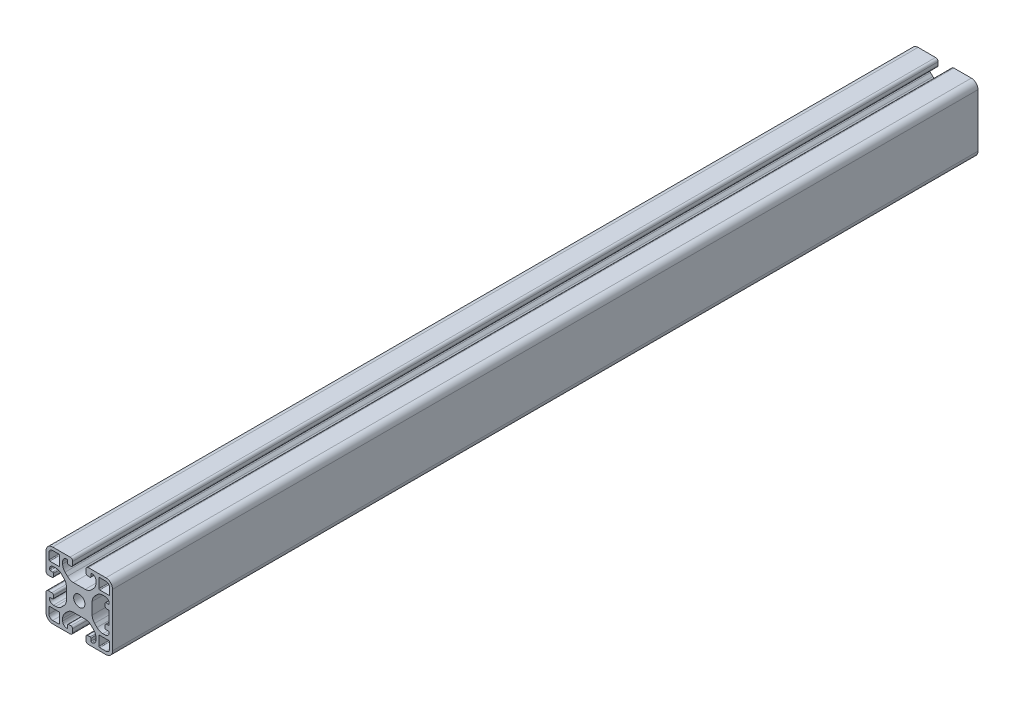
from build123d import *

# Parameters (mm, degrees)
SCHIZZO1_R                   = 3.4
ESTRUSIONE_ESTRUSIONE1_DEPTH = 520


with BuildPart() as part:
    # Schizzo1 → Estrusione-Estrusione1 (new body)
    with BuildSketch(Plane(origin=(0, 0, -340), x_dir=(-1, 0, 0), z_dir=(0, 0, -1))):
        with BuildLine():
            Line((6.5, -15.5), (5, -15.5))
            ThreePointArc((5, -15.5), (4.292893219, -15.792893219), (4, -16.5))
            Line((4, -16.5), (4, -18.5))
            ThreePointArc((4, -18.5), (4.439339828, -19.560660172), (5.5, -20))
            Line((5.5, -20), (16, -20))
            ThreePointArc((16, -20), (18.828427125, -18.828427125), (20, -16))
            Line((20, -16), (20, -5.5))
            ThreePointArc((20, -5.5), (19.560660172, -4.439339828), (18.5, -4))
            Line((18.5, -4), (16.5, -4))
            ThreePointArc((16.5, -4), (15.792893219, -4.292893219), (15.5, -5))
            Line((15.5, -5), (15.5, -6.5))
            ThreePointArc((15.5, -6.5), (15.646446609, -6.853553391), (16, -7))
            Line((16, -7), (17.55, -7))
            ThreePointArc((17.55, -7), (17.868198052, -7.131801948), (18, -7.45))
            Line((18, -7.45), (18, -7.5))
            ThreePointArc((18, -7.5), (17.267766953, -9.267766953), (15.5, -10))
            Line((15.5, -10), (14.192388155, -10))
            ThreePointArc((14.192388155, -10), (12.278970994, -9.619397663), (10.656854249, -8.535533906))
            Line((10.656854249, -8.535533906), (9.214466094, -7.09314575))
            ThreePointArc((9.214466094, -7.09314575), (8.130602337, -5.471029006), (7.75, -3.557611845))
            Line((7.75, -3.557611845), (7.75, 3.557611845))
            ThreePointArc((7.75, 3.557611845), (8.130602337, 5.471029006), (9.214466094, 7.09314575))
            Line((9.214466094, 7.09314575), (10.656854249, 8.535533906))
            ThreePointArc((10.656854249, 8.535533906), (12.278970994, 9.619397663), (14.192388155, 10))
            Line((14.192388155, 10), (15.5, 10))
            ThreePointArc((15.5, 10), (17.267766953, 9.267766953), (18, 7.5))
            Line((18, 7.5), (18, 7.45))
            ThreePointArc((18, 7.45), (17.868198052, 7.131801948), (17.55, 7))
            Line((17.55, 7), (16, 7))
            ThreePointArc((16, 7), (15.646446609, 6.853553391), (15.5, 6.5))
            Line((15.5, 6.5), (15.5, 5))
            ThreePointArc((15.5, 5), (15.792893219, 4.292893219), (16.5, 4))
            Line((16.5, 4), (18.5, 4))
            ThreePointArc((18.5, 4), (19.560660172, 4.439339828), (20, 5.5))
            Line((20, 5.5), (20, 16))
            ThreePointArc((20, 16), (18.828427125, 18.828427125), (16, 20))
            Line((16, 20), (5.5, 20))
            ThreePointArc((5.5, 20), (4.439339828, 19.560660172), (4, 18.5))
            Line((4, 18.5), (4, 16.5))
            ThreePointArc((4, 16.5), (4.292893219, 15.792893219), (5, 15.5))
            Line((5, 15.5), (6.5, 15.5))
            ThreePointArc((6.5, 15.5), (6.853553391, 15.646446609), (7, 16))
            Line((7, 16), (7, 17.55))
            ThreePointArc((7, 17.55), (7.131801948, 17.868198052), (7.45, 18))
            Line((7.45, 18), (7.5, 18))
            ThreePointArc((7.5, 18), (9.267766953, 17.267766953), (10, 15.5))
            Line((10, 15.5), (10, 14.192388155))
            ThreePointArc((10, 14.192388155), (9.619397663, 12.278970994), (8.535533906, 10.656854249))
            Line((8.535533906, 10.656854249), (7.09314575, 9.214466094))
            ThreePointArc((7.09314575, 9.214466094), (5.471029006, 8.130602337), (3.557611844, 7.75))
            Line((3.557611844, 7.75), (-3.557611845, 7.75))
            ThreePointArc((-3.557611845, 7.75), (-5.471029006, 8.130602337), (-7.09314575, 9.214466094))
            Line((-7.09314575, 9.214466094), (-8.535533906, 10.656854249))
            ThreePointArc((-8.535533906, 10.656854249), (-9.619397663, 12.278970994), (-10, 14.192388155))
            Line((-10, 14.192388155), (-10, 15.5))
            ThreePointArc((-10, 15.5), (-9.267766953, 17.267766953), (-7.5, 18))
            Line((-7.5, 18), (-7.45, 18))
            ThreePointArc((-7.45, 18), (-7.131801948, 17.868198052), (-7, 17.55))
            Line((-7, 17.55), (-7, 16))
            ThreePointArc((-7, 16), (-6.853553391, 15.646446609), (-6.5, 15.5))
            Line((-6.5, 15.5), (-5, 15.5))
            ThreePointArc((-5, 15.5), (-4.292893219, 15.792893219), (-4, 16.5))
            Line((-4, 16.5), (-4, 18.5))
            ThreePointArc((-4, 18.5), (-4.439339828, 19.560660172), (-5.5, 20))
            Line((-5.5, 20), (-16, 20))
            ThreePointArc((-16, 20), (-18.828427125, 18.828427125), (-20, 16))
            Line((-20, 16), (-20, -16))
            ThreePointArc((-20, -16), (-18.828427125, -18.828427125), (-16, -20))
            Line((-16, -20), (-5.5, -20))
            ThreePointArc((-5.5, -20), (-4.439339828, -19.560660172), (-4, -18.5))
            Line((-4, -18.5), (-4, -16.5))
            ThreePointArc((-4, -16.5), (-4.292893219, -15.792893219), (-5, -15.5))
            Line((-5, -15.5), (-6.5, -15.5))
            ThreePointArc((-6.5, -15.5), (-6.853553391, -15.646446609), (-7, -16))
            Line((-7, -16), (-7, -17.55))
            ThreePointArc((-7, -17.55), (-7.131801948, -17.868198052), (-7.45, -18))
            Line((-7.45, -18), (-7.5, -18))
            ThreePointArc((-7.5, -18), (-9.267766953, -17.267766953), (-10, -15.5))
            Line((-10, -15.5), (-10, -14.192388155))
            ThreePointArc((-10, -14.192388155), (-9.619397663, -12.278970994), (-8.535533906, -10.656854249))
            Line((-8.535533906, -10.656854249), (-7.09314575, -9.214466094))
            ThreePointArc((-7.09314575, -9.214466094), (-5.471029006, -8.130602337), (-3.557611845, -7.75))
            Line((-3.557611845, -7.75), (3.557611845, -7.75))
            ThreePointArc((3.557611845, -7.75), (5.471029006, -8.130602337), (7.09314575, -9.214466094))
            Line((7.09314575, -9.214466094), (8.535533906, -10.656854249))
            ThreePointArc((8.535533906, -10.656854249), (9.619397663, -12.278970994), (10, -14.192388155))
            Line((10, -14.192388155), (10, -15.5))
            ThreePointArc((10, -15.5), (9.267766953, -17.267766953), (7.5, -18))
            Line((7.5, -18), (7.45, -18))
            ThreePointArc((7.45, -18), (7.131801948, -17.868198052), (7, -17.55))
            Line((7, -17.55), (7, -16))
            ThreePointArc((7, -16), (6.853553391, -15.646446609), (6.5, -15.5))
        make_face()
        with Locations(Location((0, 0, 0), (0, 0, 180))):
            Circle(SCHIZZO1_R, mode=Mode.SUBTRACT)
        with BuildLine():
            Line((-12.3, -18.2), (-16, -18.2))
            ThreePointArc((-16, -18.2), (-17.555634919, -17.555634919), (-18.2, -16))
            Line((-18.2, -16), (-18.2, -12.3))
            ThreePointArc((-18.2, -12.3), (-18.053553391, -11.946446609), (-17.7, -11.8))
            Line((-17.7, -11.8), (-12.3, -11.8))
            ThreePointArc((-12.3, -11.8), (-11.946446609, -11.946446609), (-11.8, -12.3))
            Line((-11.8, -12.3), (-11.8, -17.7))
            ThreePointArc((-11.8, -17.7), (-11.946446609, -18.053553391), (-12.3, -18.2))
        make_face(mode=Mode.SUBTRACT)
        with BuildLine():
            Line((-11.8, 17.7), (-11.8, 12.3))
            ThreePointArc((-11.8, 12.3), (-11.946446609, 11.946446609), (-12.3, 11.8))
            Line((-12.3, 11.8), (-17.7, 11.8))
            ThreePointArc((-17.7, 11.8), (-18.053553391, 11.946446609), (-18.2, 12.3))
            Line((-18.2, 12.3), (-18.2, 16))
            ThreePointArc((-18.2, 16), (-17.555634919, 17.555634919), (-16, 18.2))
            Line((-16, 18.2), (-12.3, 18.2))
            ThreePointArc((-12.3, 18.2), (-11.946446609, 18.053553391), (-11.8, 17.7))
        make_face(mode=Mode.SUBTRACT)
        with BuildLine():
            Line((18.2, 16), (18.2, 12.3))
            ThreePointArc((18.2, 12.3), (18.053553391, 11.946446609), (17.7, 11.8))
            Line((17.7, 11.8), (12.3, 11.8))
            ThreePointArc((12.3, 11.8), (11.946446609, 11.946446609), (11.8, 12.3))
            Line((11.8, 12.3), (11.8, 17.7))
            ThreePointArc((11.8, 17.7), (11.946446609, 18.053553391), (12.3, 18.2))
            Line((12.3, 18.2), (16, 18.2))
            ThreePointArc((16, 18.2), (17.555634919, 17.555634919), (18.2, 16))
        make_face(mode=Mode.SUBTRACT)
        with BuildLine():
            Line((18.2, -12.3), (18.2, -16))
            ThreePointArc((18.2, -16), (17.555634919, -17.555634919), (16, -18.2))
            Line((16, -18.2), (12.3, -18.2))
            ThreePointArc((12.3, -18.2), (11.946446609, -18.053553391), (11.8, -17.7))
            Line((11.8, -17.7), (11.8, -12.3))
            ThreePointArc((11.8, -12.3), (11.946446609, -11.946446609), (12.3, -11.8))
            Line((12.3, -11.8), (17.7, -11.8))
            ThreePointArc((17.7, -11.8), (18.053553391, -11.946446609), (18.2, -12.3))
        make_face(mode=Mode.SUBTRACT)
        with BuildLine():
            Line((-16, 7), (-17.5, 7))
            ThreePointArc((-17.5, 7), (-17.853553391, 7.146446609), (-18, 7.5))
            ThreePointArc((-18, 7.5), (-17.267766953, 9.267766953), (-15.5, 10))
            Line((-15.5, 10), (-14.192388155, 10))
            ThreePointArc((-14.192388155, 10), (-12.278970994, 9.619397663), (-10.656854249, 8.535533906))
            Line((-10.656854249, 8.535533906), (-9.214466094, 7.093145751))
            ThreePointArc((-9.214466094, 7.093145751), (-8.130602337, 5.471029006), (-7.75, 3.557611845))
            Line((-7.75, 3.557611845), (-7.75, -3.557611845))
            ThreePointArc((-7.75, -3.557611845), (-8.130602337, -5.471029006), (-9.214466094, -7.093145751))
            Line((-9.214466094, -7.093145751), (-10.656854249, -8.535533906))
            ThreePointArc((-10.656854249, -8.535533906), (-12.278970994, -9.619397663), (-14.192388155, -10))
            Line((-14.192388155, -10), (-15.5, -10))
            ThreePointArc((-15.5, -10), (-17.267766953, -9.267766953), (-18, -7.5))
            ThreePointArc((-18, -7.5), (-17.853553391, -7.146446609), (-17.5, -7))
            Line((-17.5, -7), (-16, -7))
            ThreePointArc((-16, -7), (-15.646446609, -6.853553391), (-15.5, -6.5))
            Line((-15.5, -6.5), (-15.5, -5))
            ThreePointArc((-15.5, -5), (-15.792893219, -4.292893219), (-16.5, -4))
            Line((-16.5, -4), (-17.5, -4))
            ThreePointArc((-17.5, -4), (-17.853553391, -3.853553391), (-18, -3.5))
            Line((-18, -3.5), (-18, 3.5))
            ThreePointArc((-18, 3.5), (-17.853553391, 3.853553391), (-17.5, 4))
            Line((-17.5, 4), (-16.5, 4))
            ThreePointArc((-16.5, 4), (-15.792893219, 4.292893219), (-15.5, 5))
            Line((-15.5, 5), (-15.5, 6.5))
            ThreePointArc((-15.5, 6.5), (-15.646446609, 6.853553391), (-16, 7))
        make_face(mode=Mode.SUBTRACT)
    extrude(amount=-ESTRUSIONE_ESTRUSIONE1_DEPTH)


solid = part.part
